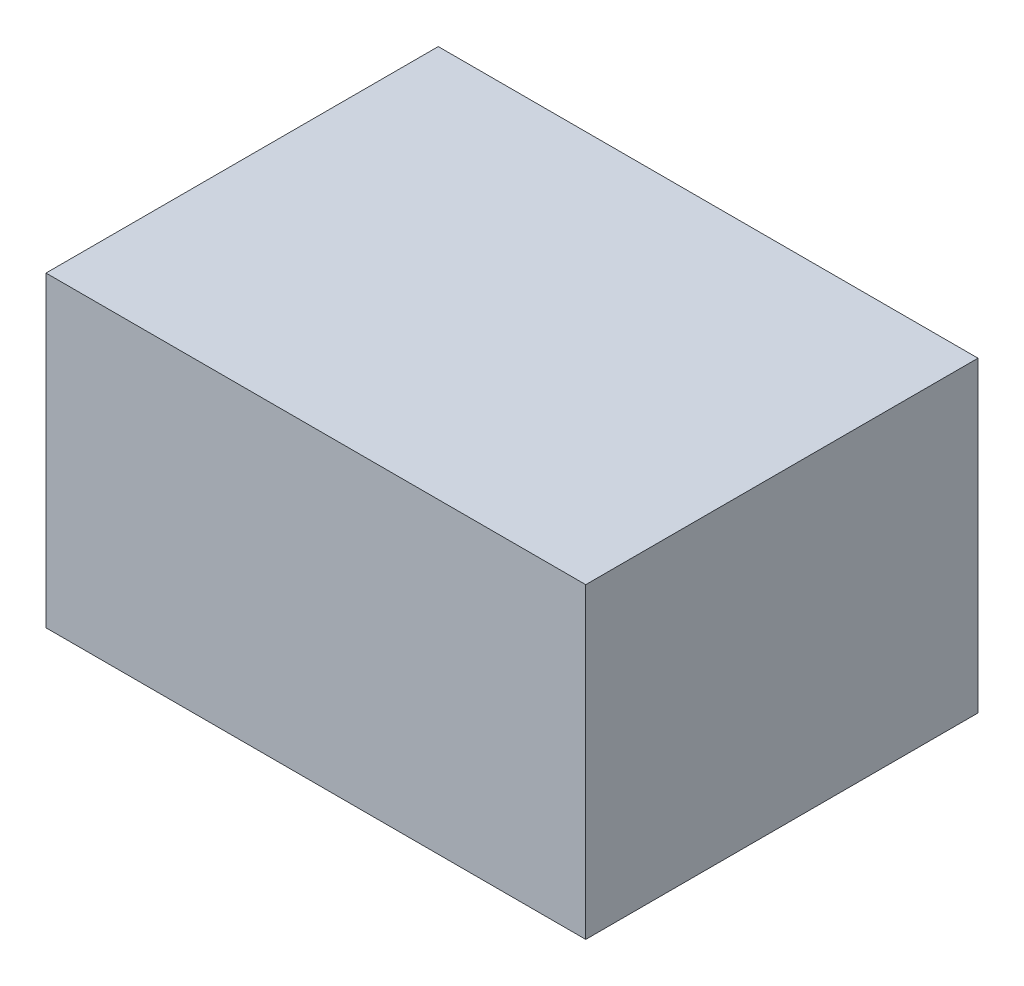
from build123d import *

# Parameters (mm, degrees)
SKETCH1_W      = 52.7
SKETCH1_H      = 30
ENVELOPE_DEPTH = 38.3


with BuildPart() as part:
    # Sketch1 → Envelope (new body)
    with BuildSketch(Plane.XY):
        Rectangle(SKETCH1_W, SKETCH1_H)
    extrude(amount=ENVELOPE_DEPTH)


solid = part.part
